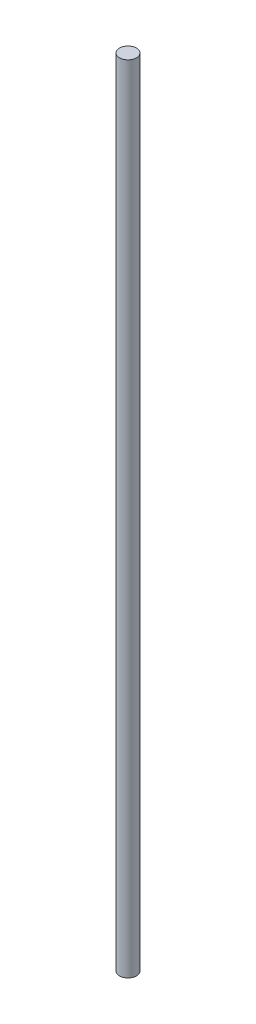
from build123d import *

# Parameters (mm, degrees)
SKETCH1_R           = 4
BOSS_EXTRUDE1_DEPTH = 375


with BuildPart() as part:
    # Sketch1 → Boss-Extrude1 (new body)
    with BuildSketch(Plane(origin=(0, 0, 0), x_dir=(1, 0, 0), z_dir=(0, 1, 0))):
        with Locations(Location((0, 0, 0), (0, 0, 270))):
            Circle(SKETCH1_R)
    extrude(amount=BOSS_EXTRUDE1_DEPTH)


solid = part.part
